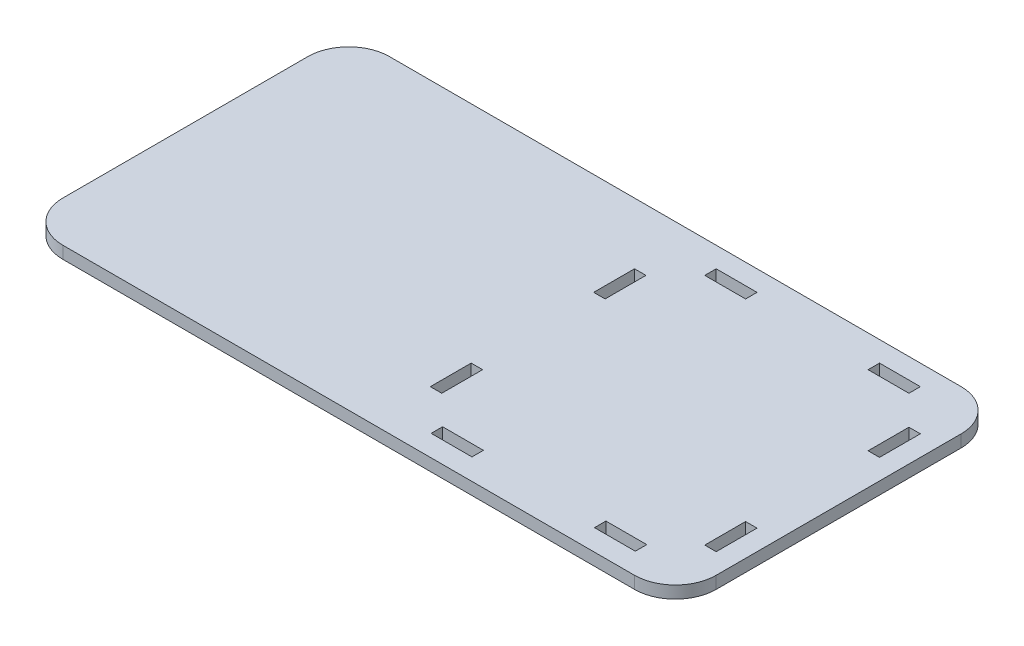
from build123d import *

# Parameters (mm, degrees)
BOSS_EXTRU_1_DEPTH      = 3
ESQUISSE4_W             = 10
ESQUISSE4_H             = 2.8
ENL_V_MAT_EXTRU_2_DEPTH = 179.910592196
ESQUISSE5_W             = 2.8
ESQUISSE5_H             = 10
ENL_V_MAT_EXTRU_3_DEPTH = 179.910592196


with BuildPart() as part:
    # Esquisse2 → Boss.-Extru.1 (new body)
    with BuildSketch(Plane(origin=(0, 0, 0), x_dir=(1, 0, 0), z_dir=(0, 1, 0))):
        with BuildLine():
            Line((10, 0), (150, 0))
            ThreePointArc((150, 0), (157.071067812, 2.928932188), (160, 10))
            Line((160, 10), (160, 70))
            ThreePointArc((160, 70), (157.071067812, 77.071067812), (150, 80))
            Line((150, 80), (10, 80))
            ThreePointArc((10, 80), (2.928932188, 77.071067812), (0, 70))
            Line((0, 70), (0, 10))
            ThreePointArc((0, 10), (2.928932188, 2.928932188), (10, 0))
        make_face()
    extrude(amount=BOSS_EXTRU_1_DEPTH)

    # Esquisse4 → Enlèv. mat.-Extru.2 (cut, through all)
    with BuildSketch(Plane(origin=(0, 3, 0), x_dir=(1, 0, 0), z_dir=(0, 1, 0))):
        with Locations((140, 73.6)):
            Rectangle(ESQUISSE4_W, ESQUISSE4_H)
        with Locations((100, 73.6)):
            Rectangle(ESQUISSE4_W, ESQUISSE4_H)
        with Locations((100, 6.6)):
            Rectangle(ESQUISSE4_W, ESQUISSE4_H)
        with Locations((140, 6.6)):
            Rectangle(ESQUISSE4_W, ESQUISSE4_H)
    extrude(amount=-ENL_V_MAT_EXTRU_2_DEPTH, mode=Mode.SUBTRACT)

    # Esquisse5 → Enlèv. mat.-Extru.3 (cut, through all)
    with BuildSketch(Plane(origin=(0, 3, 0), x_dir=(1, 0, 0), z_dir=(0, 1, 0))):
        with Locations((153.6, 60)):
            Rectangle(ESQUISSE5_W, ESQUISSE5_H)
        with Locations((86.4, 60)):
            Rectangle(ESQUISSE5_W, ESQUISSE5_H)
        with Locations((86.4, 20)):
            Rectangle(ESQUISSE5_W, ESQUISSE5_H)
        with Locations((153.6, 20)):
            Rectangle(ESQUISSE5_W, ESQUISSE5_H)
    extrude(amount=-ENL_V_MAT_EXTRU_3_DEPTH, mode=Mode.SUBTRACT)


solid = part.part
